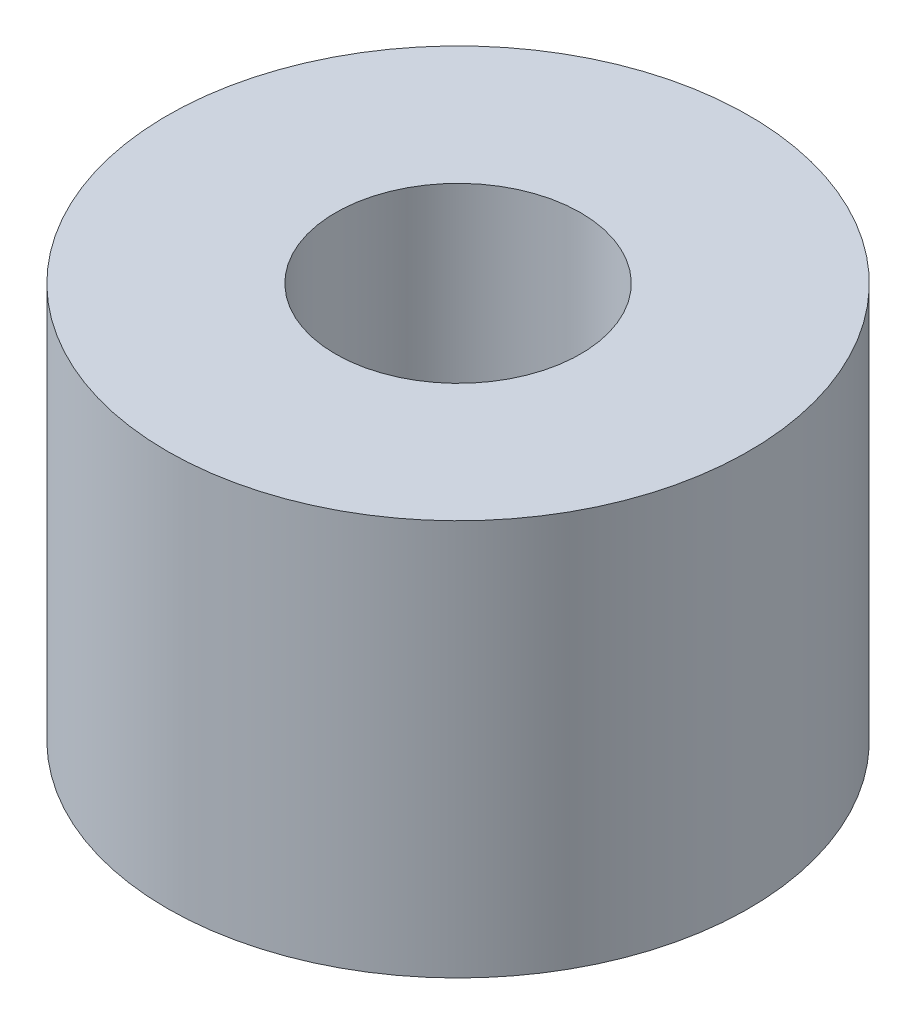
from build123d import *

# Parameters (mm, degrees)
SKETCH1_W = 3.4
SKETCH1_H = 8


with BuildPart() as part:
    # Sketch1 → Revolve1 (revolve)
    with BuildSketch(Plane.XY, mode=Mode.PRIVATE) as revolve1_sk:
        with Locations((4.175, 4)):
            Rectangle(SKETCH1_W, SKETCH1_H)
    revolve(revolve1_sk.sketch.rotate(Axis((0, 21.748581963, 0), (0, -1, 0)), 90), axis=Axis((0, 21.748581963, 0), (0, -1, 0)))


solid = part.part
